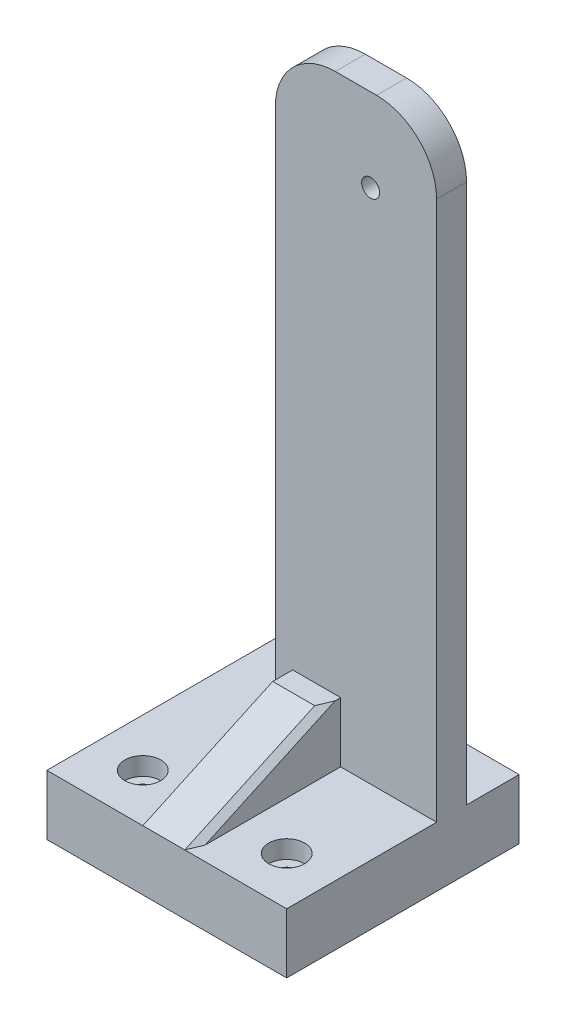
from build123d import *

# Parameters (mm, degrees)
SKETCH1_W           = 40
SKETCH1_H           = 24.2
SKETCH1_H_2         = 5.8
BOSS_EXTRUDE1_DEPTH = 10
SKETCH2_W           = 26.88873999
SKETCH2_H           = 5
BOSS_EXTRUDE2_DEPTH = 100
SKETCH3_R           = 1.5
CUT_EXTRUDE1_DEPTH  = 30
SKETCH6_W           = 8
SKETCH6_H           = 25
BOSS_EXTRUDE3_DEPTH = 10
CUT_EXTRUDE4_DEPTH  = 35
BOSS_EXTRUDE4_DEPTH = 10
SKETCH9_W           = 8
SKETCH9_H           = 15
BOSS_EXTRUDE5_DEPTH = 30
CUT_EXTRUDE5_DEPTH  = 35
SKETCH11_R          = 1.42
CUT_EXTRUDE6_DEPTH  = 20
SKETCH12_R          = 3
CUT_EXTRUDE7_DEPTH  = 3
FILLET1_R           = 10
CHAMFER1_SIZE       = 1
CHAMFER2_SIZE       = 1


with BuildPart() as part:
    # Sketch1 → Boss-Extrude1 (new body)
    with BuildSketch(Plane(origin=(0, 0, 0), x_dir=(1, 0, 0), z_dir=(0, 1, 0))):
        with Locations((0, -2.9)):
            Rectangle(SKETCH1_W, SKETCH1_H)
        with Locations((0, 12.1)):
            Rectangle(SKETCH1_W, SKETCH1_H_2)
    extrude(amount=BOSS_EXTRUDE1_DEPTH)

    # Sketch2 → Boss-Extrude2 (add)
    with BuildSketch(Plane(origin=(0, 10, 0), x_dir=(1, 0, 0), z_dir=(0, 1, 0))):
        with Locations((6.555630005, 12.5)):
            Rectangle(SKETCH2_W, SKETCH2_H)
    extrude(amount=BOSS_EXTRUDE2_DEPTH)

    # Sketch3 → Cut-Extrude1 (cut)
    with BuildSketch(Plane.XY.offset(-10)):
        with Locations((9, 96.14)):
            Circle(SKETCH3_R)
    extrude(amount=-CUT_EXTRUDE1_DEPTH, mode=Mode.SUBTRACT)

    # Sketch6 → Boss-Extrude3 (add)
    with BuildSketch(Plane(origin=(0, 10, 0), x_dir=(1, 0, 0), z_dir=(0, 1, 0))):
        with Locations((0, -2.5)):
            Rectangle(SKETCH6_W, SKETCH6_H)
    extrude(amount=BOSS_EXTRUDE3_DEPTH)

    # Sketch7 → Cut-Extrude4 (cut)
    with BuildSketch(Plane.ZY.offset(4)):
        Polygon((-10, 21.535084573), (15, 10), (15, 21.535084573), align=None)
    extrude(amount=-CUT_EXTRUDE4_DEPTH, mode=Mode.SUBTRACT)

    # Sketch8 → Boss-Extrude4 (add)
    with BuildSketch(Plane(origin=(0, 0, 0), x_dir=(1, 0, 0), z_dir=(0, 1, 0))):
        Polygon((-20, 30), (-20, 15), (20, 15), (20, 23.768276438), (4, 23.768276438), (4, 30), align=None)
    extrude(amount=BOSS_EXTRUDE4_DEPTH)

    # Sketch9 → Boss-Extrude5 (add)
    with BuildSketch(Plane(origin=(0, 10, 0), x_dir=(1, 0, 0), z_dir=(0, 1, 0))):
        with Locations((0, 22.5)):
            Rectangle(SKETCH9_W, SKETCH9_H)
    extrude(amount=BOSS_EXTRUDE5_DEPTH)

    # Sketch10 → Cut-Extrude5 (cut)
    with BuildSketch(Plane.ZY.offset(4)):
        Polygon((-30, 10), (-20.186840819, 40), (-30, 40), align=None)
    extrude(amount=-CUT_EXTRUDE5_DEPTH, mode=Mode.SUBTRACT)

    # Sketch11 → Cut-Extrude6 (cut)
    with BuildSketch(Plane(origin=(0, 10, 0), x_dir=(1, 0, 0), z_dir=(0, 1, 0))):
        with Locations(Location((-12, -7, 0), (0, 0, 270))):
            Circle(SKETCH11_R)
        with Locations(Location((12, -7, 0), (0, 0, 270))):
            Circle(SKETCH11_R)
        with Locations(Location((-12, 23, 0), (0, 0, 270))):
            Circle(SKETCH11_R)
    extrude(amount=-CUT_EXTRUDE6_DEPTH, mode=Mode.SUBTRACT)

    # Sketch12 → Cut-Extrude7 (cut)
    with BuildSketch(Plane(origin=(0, 10, 0), x_dir=(1, 0, 0), z_dir=(0, 1, 0))):
        with Locations(Location((-12, -7, 0), (0, 0, 270))):
            Circle(SKETCH12_R)
        with Locations(Location((12, -7, 0), (0, 0, 270))):
            Circle(SKETCH12_R)
        with Locations(Location((-12, 23, 0), (0, 0, 270))):
            Circle(SKETCH12_R)
    extrude(amount=-CUT_EXTRUDE7_DEPTH, mode=Mode.SUBTRACT)

    # Fillet1
    fillet1_edges = [part.edges().sort_by_distance(p)[0] for p in [
        (-6.88873999, 110, -12.5),
        (20, 110, -12.5),
    ]]
    fillet(fillet1_edges, radius=FILLET1_R)

    # Chamfer1
    chamfer1_edges = [part.edges().sort_by_distance(p)[0] for p in [
        (4, 25, -25.093420409),
        (-4, 25, -25.093420409),
    ]]
    chamfer(chamfer1_edges, length=CHAMFER1_SIZE)

    # Chamfer2
    chamfer2_edges = [part.edges().sort_by_distance(p)[0] for p in [
        (4, 15, 4.163495143),
    ]]
    chamfer(chamfer2_edges, length=CHAMFER2_SIZE)


solid = part.part
